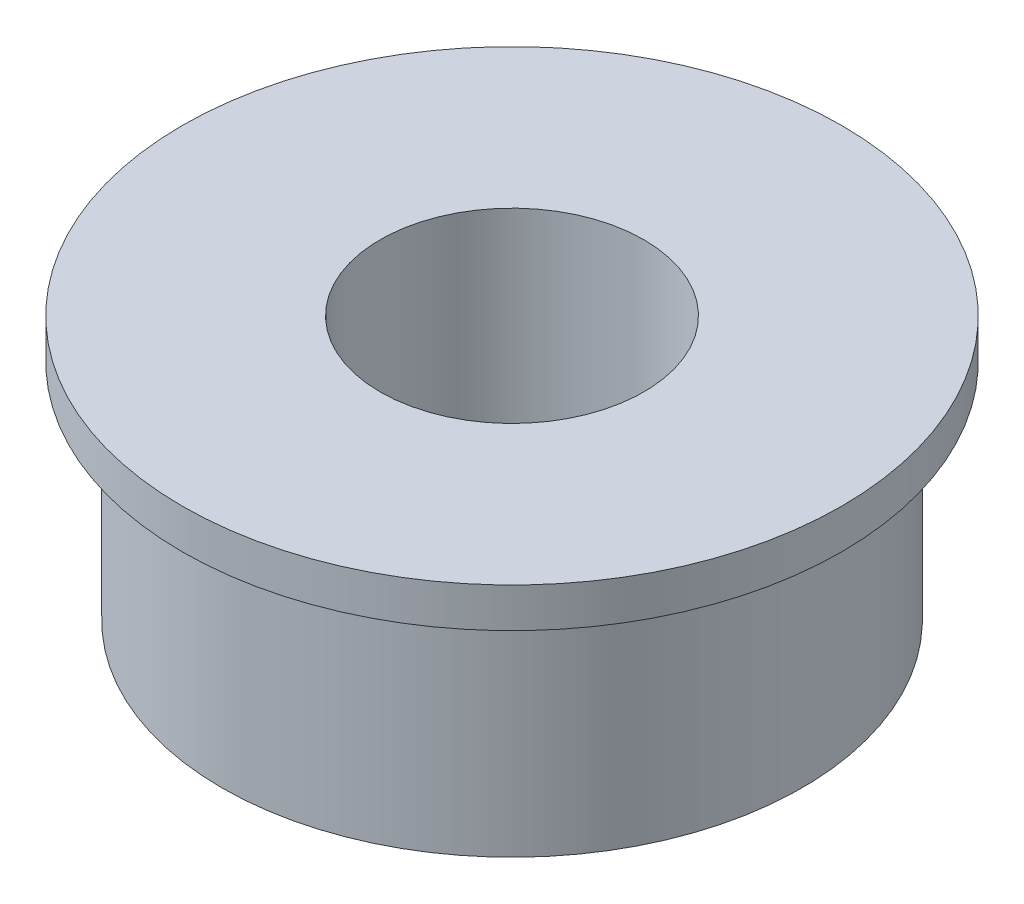
from build123d import *


with BuildPart() as part:
    # Sketch1 → Revolve1 (revolve)
    with BuildSketch(Plane.XY, mode=Mode.PRIVATE) as revolve1_sk:
        Polygon((-2.5, 0), (-5.5, 0), (-5.5, 4.25), (-6.25, 4.25), (-6.25, 5), (-2.5, 5), align=None)
    revolve(revolve1_sk.sketch.rotate(Axis((0, 5.755208333, 0), (0, -1, 0)), 270), axis=Axis((0, 5.755208333, 0), (0, -1, 0)))


solid = part.part
